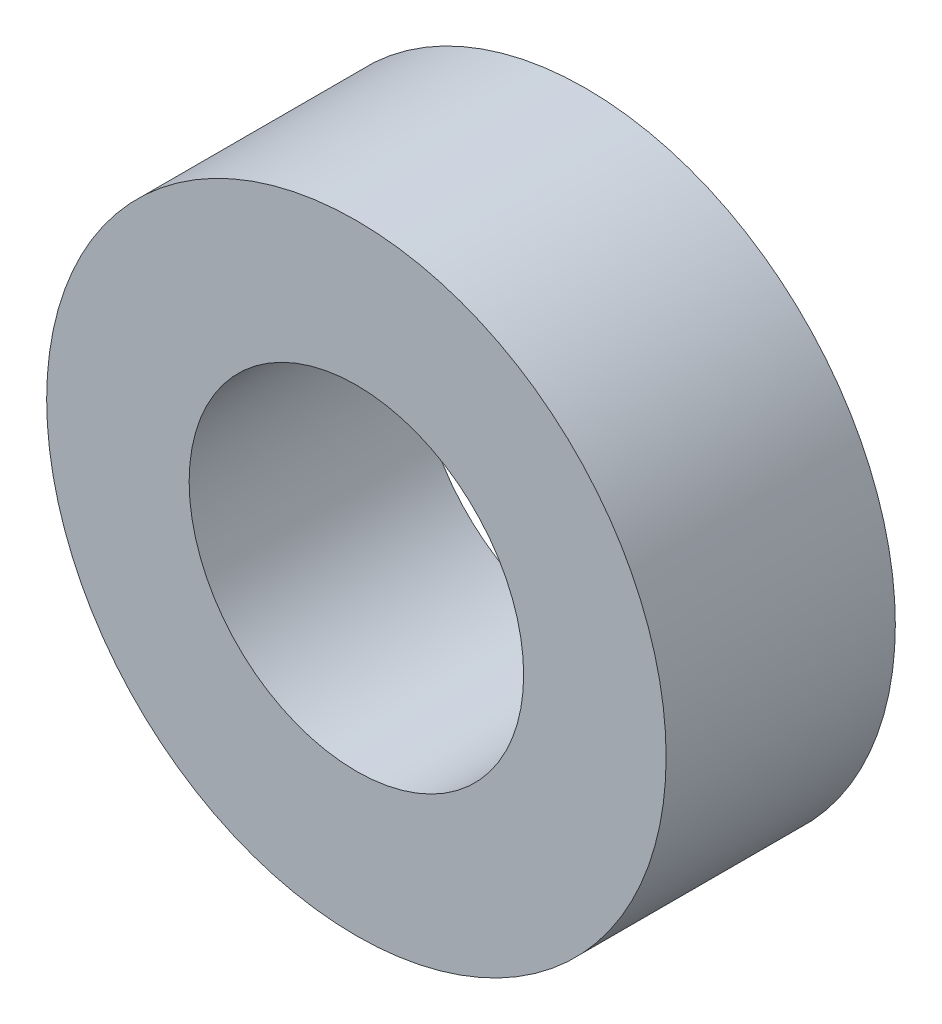
from build123d import *

# Parameters (mm, degrees)
SKETCH1_R           = 6.35
SKETCH1_R_2         = 3.429
BOSS_EXTRUDE1_DEPTH = 4.699


with BuildPart() as part:
    # Sketch1 → Boss-Extrude1 (new body)
    with BuildSketch(Plane.XY):
        Circle(SKETCH1_R)
        Circle(SKETCH1_R_2, mode=Mode.SUBTRACT)
    extrude(amount=BOSS_EXTRUDE1_DEPTH)


solid = part.part
